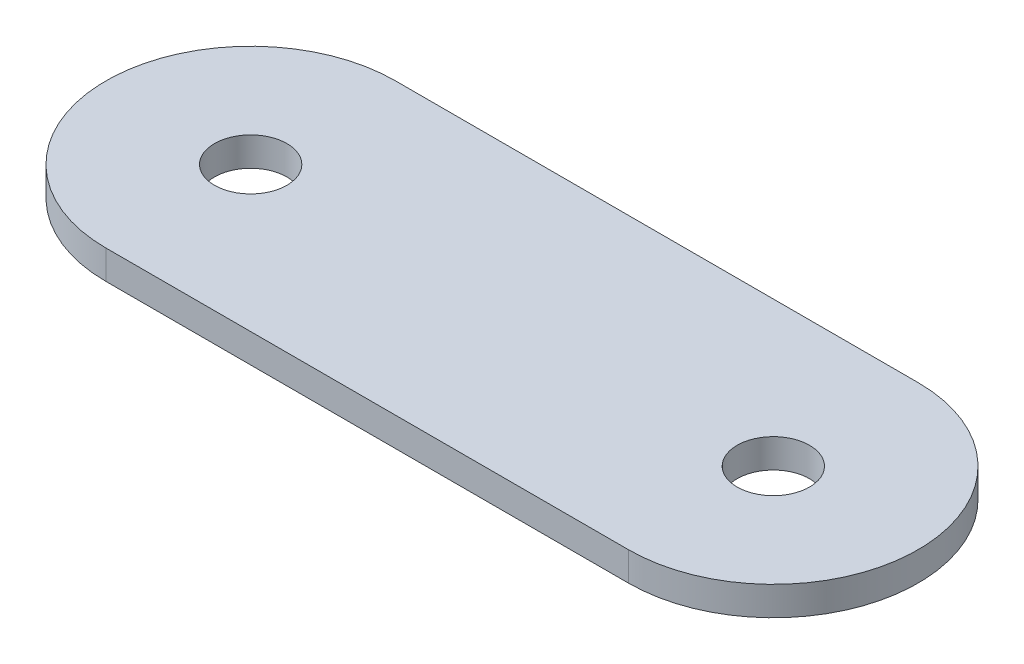
from build123d import *

# Parameters (mm, degrees)
IZIM1_R                     = 2.5
Y_KSEKLIK_EKSTR_ZYON1_DEPTH = 2


with BuildPart() as part:
    # Çizim1 → Yükseklik-Ekstrüzyon1 (new body)
    with BuildSketch(Plane(origin=(0, 0, 0), x_dir=(1, 0, 0), z_dir=(0, 1, 0))):
        with BuildLine():
            Line((-18.05, 10), (18.05, 10))
            ThreePointArc((18.05, 10), (28.05, 0), (18.05, -10))
            Line((18.05, -10), (-18.05, -10))
            ThreePointArc((-18.05, -10), (-28.05, 0), (-18.05, 10))
        make_face()
        with Locations(Location((-18.05, 0, 0), (0, 0, 270))):
            Circle(IZIM1_R, mode=Mode.SUBTRACT)
        with Locations(Location((18.05, 0, 0), (0, 0, 270))):
            Circle(IZIM1_R, mode=Mode.SUBTRACT)
    extrude(amount=Y_KSEKLIK_EKSTR_ZYON1_DEPTH)


solid = part.part
